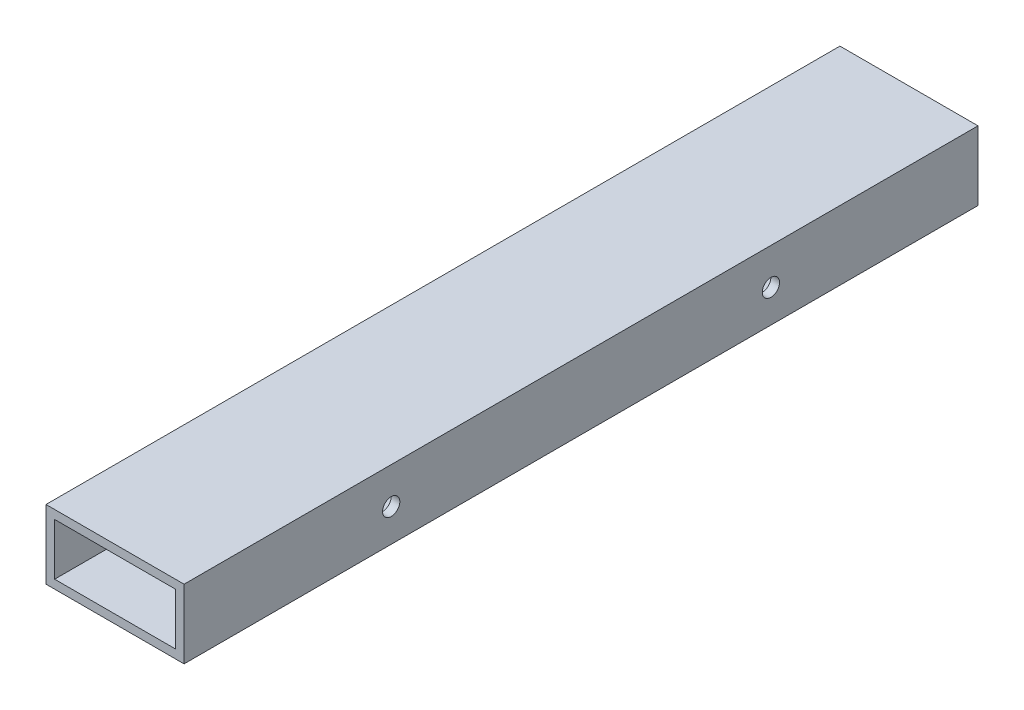
from build123d import *

# Parameters (mm, degrees)
SKETCH1_W               = 50.8
SKETCH1_H               = 25.4
SKETCH1_W_2             = 44.45
SKETCH1_H_2             = 19.05
BOSS_EXTRUDE1_DEPTH     = 292.1
CUT_EXTRUDE1_DEPTH      = 298.570512652
CUT_EXTRUDE1_DEPTH_BACK = 298.570512652
SKETCH2_R               = 3.175


with BuildPart() as part:
    # Sketch1 → Boss-Extrude1 (new body)
    with BuildSketch(Plane.XY):
        with Locations((25.4, 12.7)):
            Rectangle(SKETCH1_W, SKETCH1_H)
        with Locations((25.4, 12.7)):
            Rectangle(SKETCH1_W_2, SKETCH1_H_2, mode=Mode.SUBTRACT)
    extrude(amount=BOSS_EXTRUDE1_DEPTH)

    # Sketch2 → Cut-Extrude1 (cut, two sides: drawn at the far end of the back side and taken through both)
    with BuildSketch(Plane(origin=(50.8, 0, 0), x_dir=(0, 0, -1), z_dir=(1, 0, 0)).offset(-CUT_EXTRUDE1_DEPTH_BACK)):
        with Locations((-215.9, 12.026758398)):
            Circle(SKETCH2_R)
        with Locations((-76.2, 12.026758398)):
            Circle(SKETCH2_R)
    extrude(amount=CUT_EXTRUDE1_DEPTH + CUT_EXTRUDE1_DEPTH_BACK, mode=Mode.SUBTRACT)


solid = part.part
